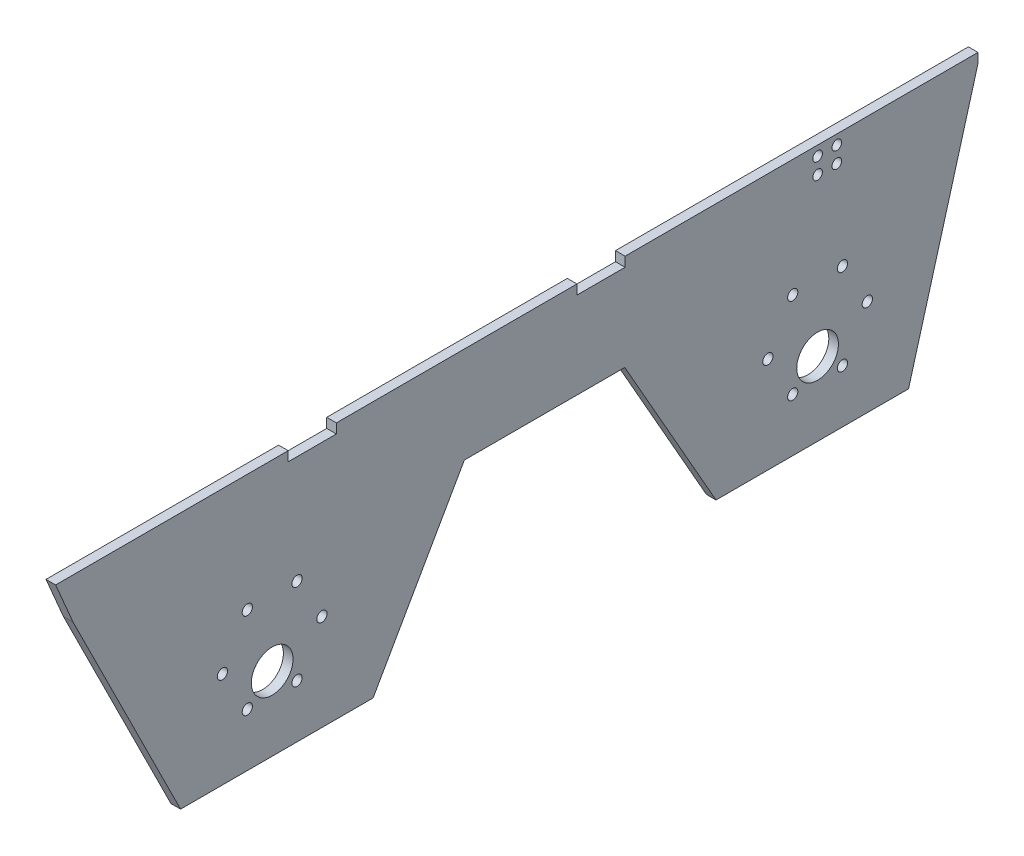
from build123d import *

# Parameters (mm, degrees)
EXTRUDE_1_DEPTH           = 150
EXTRUDE_1_DEPTH_BACK      = 150
SKETCH_4_R                = 2.5
CUT_EXTRUDE_4_DEPTH       = 3
SKETCH_5_W                = 52
SKETCH_5_H                = 100
CUT_EXTRUDE_5_DEPTH       = 3
SKETCH_7_R                = 1.6
SKETCH_7_R_2              = 6.5
CUT_EXTRUDE_9_DEPTH       = 185.063533313
SKETCH_6_W                = 40
SKETCH_6_H                = 200
CUT_EXTRUDE_10_DEPTH      = 10
CUT_EXTRUDE_12_DEPTH      = 4
SKETCH_12_W               = 34
SKETCH_12_H               = 110
CUT_EXTRUDE_13_DEPTH      = 4
SKETCH_14_W               = 4.2
SKETCH_14_H               = 14
CUT_EXTRUDE_14_DEPTH      = 10
SKETCH_15_R               = 2
CUT_EXTRUDE_15_DEPTH      = 26
SKETCH_17_R               = 1.5
CUT_EXTRUDE_19_DEPTH      = 10
CUT_EXTRUDE_20_DEPTH      = 10
CUT_EXTRUDE_21_DEPTH      = 31
SKETCH_22_R               = 1.5
CUT_EXTRUDE_22_DEPTH      = 31
SKETCH_23_W               = 12
SKETCH_23_H               = 87.5
EXTRUDE_3_DEPTH           = 3
CUT_EXTRUDE_23_DEPTH      = 18
CUT_EXTRUDE_24_DEPTH      = 13
CUT_EXTRUDE_24_DEPTH_BACK = 4
SKETCH_25_R               = 1.5
SKETCH_26_R               = 2
CUT_EXTRUDE_25_DEPTH      = 10
SKETCH_27_R               = 1.5
CUT_EXTRUDE_26_DEPTH      = 10
CUT_EXTRUDE_29_DEPTH      = 10
SKETCH_32_W               = 44.628479445
SKETCH_32_H               = 8.012675998
CUT_EXTRUDE_30_DEPTH      = 345
SKETCH_33_W               = 3
SKETCH_33_H               = 15
CUT_EXTRUDE_31_DEPTH      = 3


with BuildPart() as part:
    # 草图1 → 凸台-拉伸1 (new, two sides: drawn at the far end of the back side and taken through both)
    with BuildSketch(Plane.XY.offset(-EXTRUDE_1_DEPTH_BACK)):
        Polygon((0, 4.173281966), (0, -73.826718034), (3, -73.826718034), (3, 1.173281966), (3, 3.173281966), (5, 3.173281966), (80, 3.173281966), (80, 6.173281966), (2, 6.173281966), (0, 6.173281966), align=None)
    extrude(amount=EXTRUDE_1_DEPTH + EXTRUDE_1_DEPTH_BACK)

    # 草图4 → 切除-拉伸4 (cut)
    with BuildSketch(Plane(origin=(0, 6.173281966, 0), x_dir=(1, 0, 0), z_dir=(0, 1, 0))):
        with Locations((11.5, -72.5)):
            Circle(SKETCH_4_R)
        with Locations((11.5, -127.5)):
            Circle(SKETCH_4_R)
    extrude(amount=-CUT_EXTRUDE_4_DEPTH, mode=Mode.SUBTRACT)

    # 草图5 → 切除-拉伸5 (cut)
    with BuildSketch(Plane(origin=(0, 6.173281966, 0), x_dir=(1, 0, 0), z_dir=(0, 1, 0))):
        with Locations((54, -100)):
            Rectangle(SKETCH_5_W, SKETCH_5_H)
    extrude(amount=-CUT_EXTRUDE_5_DEPTH, mode=Mode.SUBTRACT)

    # 草图7 → 切除-拉伸9 (cut, through all)
    with BuildSketch(Plane(origin=(3, 0, 0), x_dir=(0, 0, -1), z_dir=(1, 0, 0))):
        with Locations((84.5, -43.826718034)):
            Circle(SKETCH_7_R)
        with Locations((92.25, -57.250111793)):
            Circle(SKETCH_7_R)
        with Locations((107.75, -57.250111793)):
            Circle(SKETCH_7_R)
        with Locations((115.5, -43.826718034)):
            Circle(SKETCH_7_R)
        with Locations((107.75, -30.403324275)):
            Circle(SKETCH_7_R)
        with Locations((92.25, -30.403324275)):
            Circle(SKETCH_7_R)
        with Locations((-54.5, -43.826718034)):
            Circle(SKETCH_7_R)
        with Locations((-62.25, -57.250111793)):
            Circle(SKETCH_7_R)
        with Locations((-77.75, -57.250111793)):
            Circle(SKETCH_7_R)
        with Locations((-85.5, -43.826718034)):
            Circle(SKETCH_7_R)
        with Locations((-77.75, -30.403324275)):
            Circle(SKETCH_7_R)
        with Locations((-62.25, -30.403324275)):
            Circle(SKETCH_7_R)
        with Locations((-70, -50.826718034)):
            Circle(SKETCH_7_R_2)
        with Locations((100, -50.826718034)):
            Circle(SKETCH_7_R_2)
    extrude(amount=-CUT_EXTRUDE_9_DEPTH, mode=Mode.SUBTRACT)

    # 草图6 → 切除-拉伸10 (cut)
    with BuildSketch(Plane(origin=(0, 6.173281966, 0), x_dir=(1, 0, 0), z_dir=(0, 1, 0))):
        with Locations((60, 50)):
            Rectangle(SKETCH_6_W, SKETCH_6_H)
    extrude(amount=-CUT_EXTRUDE_10_DEPTH, mode=Mode.SUBTRACT)

    # 草图11 → 切除-拉伸12 (cut)
    with BuildSketch(Plane.ZY):
        Polygon((-128.345117246, -73.826718034), (-150, -73.826718034), (-150, 3.173281966), align=None)
    extrude(amount=-CUT_EXTRUDE_12_DEPTH, mode=Mode.SUBTRACT)

    # 草图12 → 切除-拉伸13 (cut)
    with BuildSketch(Plane(origin=(0, 6.173281966, 0), x_dir=(1, 0, 0), z_dir=(0, 1, 0))):
        with Locations((23, 95)):
            Rectangle(SKETCH_12_W, SKETCH_12_H)
    extrude(amount=-CUT_EXTRUDE_13_DEPTH, mode=Mode.SUBTRACT)

    # 草图14 → 切除-拉伸14 (cut)
    with BuildSketch(Plane.XZ.offset(-3.173281966)):
        with Locations((5.1, -103)):
            Rectangle(SKETCH_14_W, SKETCH_14_H)
    extrude(amount=-CUT_EXTRUDE_14_DEPTH, mode=Mode.SUBTRACT)

    # 草图15 → 切除-拉伸15 (cut)
    with BuildSketch(Plane(origin=(0, 6.173281966, 0), x_dir=(1, 0, 0), z_dir=(0, 1, 0))):
        with Locations((32, -4.5)):
            Circle(SKETCH_15_R)
    extrude(amount=-CUT_EXTRUDE_15_DEPTH, mode=Mode.SUBTRACT)

    # 草图17 → 切除-拉伸19 (cut)
    with BuildSketch(Plane.XZ.offset(-3.173281966)):
        with Locations((23.690733746, 113.5)):
            Circle(SKETCH_17_R)
    extrude(amount=-CUT_EXTRUDE_19_DEPTH, mode=Mode.SUBTRACT)

    # 草图18 → 切除-拉伸20 (cut)
    with BuildSketch(Plane.ZY):
        Polygon((150, -73.826718034), (118.550084008, -73.826718034), (150, 0), align=None)
    extrude(amount=-CUT_EXTRUDE_20_DEPTH, mode=Mode.SUBTRACT)

    # 草图21 → 切除-拉伸21 (cut)
    with BuildSketch(Plane.ZY):
        Polygon((118.550084008, -73.826718034), (150, 0), (150, 6.173281966), (137.5, 6.173281966), (132.072189672, -6.568164552), (98.550084008, -73.826718034), align=None)
    extrude(amount=-CUT_EXTRUDE_21_DEPTH, mode=Mode.SUBTRACT)

    # 草图22 → 切除-拉伸22 (cut)
    with BuildSketch(Plane.ZY):
        with Locations((-106, 3.173281966)):
            Circle(SKETCH_22_R)
        with Locations((-100, 3.173281966)):
            Circle(SKETCH_22_R)
        with Locations((-106, -1.826718034)):
            Circle(SKETCH_22_R)
        with Locations((-100, -1.826718034)):
            Circle(SKETCH_22_R)
    extrude(amount=-CUT_EXTRUDE_22_DEPTH, mode=Mode.SUBTRACT)

    # 草图23 → 凸台-拉伸3 (add)
    with BuildSketch(Plane(origin=(0, 6.173281966, 0), x_dir=(1, 0, 0), z_dir=(0, 1, 0))):
        with Locations((34, -93.75)):
            Rectangle(SKETCH_23_W, SKETCH_23_H)
    extrude(amount=-EXTRUDE_3_DEPTH)

    # 草图24 → 切除-拉伸23 (cut)
    with BuildSketch(Plane.ZY.offset(-28)):
        Polygon((137.5, 6.173281966), (137.5, 3.173281966), (136.222010805, 3.173281966), align=None)
    extrude(amount=-CUT_EXTRUDE_23_DEPTH, mode=Mode.SUBTRACT)

    # 草图25 → 切除-拉伸24 (cut, two sides: drawn at the far end of the back side and taken through both)
    with BuildSketch(Plane(origin=(0, 6.173281966, 0), x_dir=(1, 0, 0), z_dir=(0, 1, 0)).offset(-CUT_EXTRUDE_24_DEPTH_BACK)):
        with Locations((32, -61)):
            Circle(SKETCH_25_R)
    extrude(amount=CUT_EXTRUDE_24_DEPTH + CUT_EXTRUDE_24_DEPTH_BACK, mode=Mode.SUBTRACT)

    # 草图26 → 切除-拉伸25 (cut)
    with BuildSketch(Plane.XZ.offset(-3.173281966)):
        with Locations((32, -25.5)):
            Circle(SKETCH_26_R)
    extrude(amount=-CUT_EXTRUDE_25_DEPTH, mode=Mode.SUBTRACT)

    # 草图27 → 切除-拉伸26 (cut)
    with BuildSketch(Plane.XZ.offset(-3.173281966)):
        with Locations((23.690733746, 123.5)):
            Circle(SKETCH_27_R)
    extrude(amount=-CUT_EXTRUDE_26_DEPTH, mode=Mode.SUBTRACT)

    # 草图31 → 切除-拉伸29 (cut)
    with BuildSketch(Plane(origin=(3, 0, 0), x_dir=(0, 0, -1), z_dir=(1, 0, 0))):
        Polygon((-38.550084008, -73.826718034), (-10.102483381, -23.826718034), (39.897516619, -23.826718034), (68.345117246, -73.826718034), align=None)
    extrude(amount=-CUT_EXTRUDE_29_DEPTH, mode=Mode.SUBTRACT)

    # 草图32 → 切除-拉伸30 (cut)
    with BuildSketch(Plane(origin=(0, 0, -150), x_dir=(-1, 0, 0), z_dir=(0, 0, -1))):
        with Locations((-25.314239723, 7.179619965)):
            Rectangle(SKETCH_32_W, SKETCH_32_H)
    extrude(amount=-CUT_EXTRUDE_30_DEPTH, mode=Mode.SUBTRACT)

    # 草图33 → 切除-拉伸31 (cut)
    with BuildSketch(Plane(origin=(0, 6.173281966, 0), x_dir=(1, 0, 0), z_dir=(0, 1, 0))):
        with Locations((1.5, 32.5)):
            Rectangle(SKETCH_33_W, SKETCH_33_H)
        with Locations((1.5, -57.5)):
            Rectangle(SKETCH_33_W, SKETCH_33_H)
    extrude(amount=-CUT_EXTRUDE_31_DEPTH, mode=Mode.SUBTRACT)


solid = part.part
